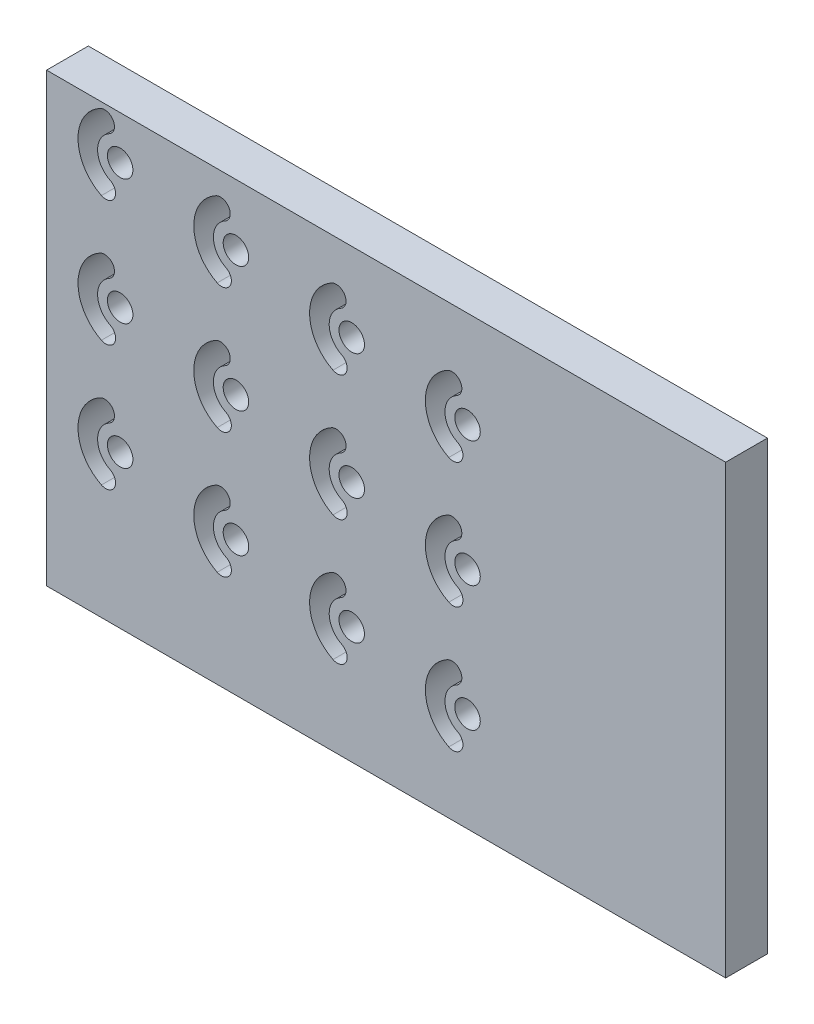
from build123d import *

# Parameters (mm, degrees)
F_1_FR_W        = 162.591921451
F_1_FR_H        = 106.952100423
F_1_FR_R        = 3.052899236
EXTRUDE_1_DEPTH = 10


with BuildPart() as part:
    # Эскиз1_fr → Бобышка-Вытянуть1 (new body)
    with BuildSketch(Plane.XY):
        with Locations((41.575310714, -4.636651753)):
            Rectangle(F_1_FR_W, F_1_FR_H)
        with Locations((-22.101373353, 38.438130748)):
            Circle(F_1_FR_R, mode=Mode.SUBTRACT)
        with Locations((5.621100062, 34.197733999)):
            Circle(F_1_FR_R, mode=Mode.SUBTRACT)
        with Locations((33.343573478, 29.95733725)):
            Circle(F_1_FR_R, mode=Mode.SUBTRACT)
        with Locations((61.066046893, 25.716940501)):
            Circle(F_1_FR_R, mode=Mode.SUBTRACT)
        with Locations((5.621100062, 4.197733999)):
            Circle(F_1_FR_R, mode=Mode.SUBTRACT)
        with Locations((33.343573478, -0.04266275)):
            Circle(F_1_FR_R, mode=Mode.SUBTRACT)
        with Locations((61.066046893, -4.283059499)):
            Circle(F_1_FR_R, mode=Mode.SUBTRACT)
        with Locations((5.621100062, -25.802266001)):
            Circle(F_1_FR_R, mode=Mode.SUBTRACT)
        with Locations((33.343573478, -30.04266275)):
            Circle(F_1_FR_R, mode=Mode.SUBTRACT)
        with Locations((61.066046893, -34.283059499)):
            Circle(F_1_FR_R, mode=Mode.SUBTRACT)
        with Locations((-22.101373353, 8.438130748)):
            Circle(F_1_FR_R, mode=Mode.SUBTRACT)
        with Locations((-22.101373353, -21.561869252)):
            Circle(F_1_FR_R, mode=Mode.SUBTRACT)
        with BuildLine():
            ThreePointArc((-26.934111294, 47.298150306), (-32.191806267, 38.242002753), (-26.586166309, 29.39700611))
            ThreePointArc((-26.586166309, 29.39700611), (-23.441936327, 30.456169349), (-24.501099566, 33.60039933))
            ThreePointArc((-24.501099566, 33.60039933), (-27.500569391, 38.33318644), (-24.687278216, 43.178956331))
            ThreePointArc((-24.687278216, 43.178956331), (-23.751097767, 46.361969857), (-26.934111294, 47.298150306))
        make_face(mode=Mode.SUBTRACT)
        with BuildLine():
            ThreePointArc((0.788362122, 43.057753557), (-4.469332851, 34.001606003), (1.136307107, 25.156609361))
            ThreePointArc((1.136307107, 25.156609361), (4.280537088, 26.2157726), (3.22137385, 29.360002581))
            ThreePointArc((3.22137385, 29.360002581), (0.221904024, 34.092789691), (3.035195199, 38.938559582))
            ThreePointArc((3.035195199, 38.938559582), (3.971375648, 42.121573108), (0.788362122, 43.057753557))
        make_face(mode=Mode.SUBTRACT)
        with BuildLine():
            ThreePointArc((28.510835537, 38.817356808), (23.253140564, 29.761209254), (28.858780522, 20.916212612))
            ThreePointArc((28.858780522, 20.916212612), (32.003010504, 21.975375851), (30.943847265, 25.119605832))
            ThreePointArc((30.943847265, 25.119605832), (27.94437744, 29.852392942), (30.757668615, 34.698162832))
            ThreePointArc((30.757668615, 34.698162832), (31.693849064, 37.881176359), (28.510835537, 38.817356808))
        make_face(mode=Mode.SUBTRACT)
        with BuildLine():
            ThreePointArc((56.233308952, 34.576960059), (50.97561398, 25.520812505), (56.581253938, 16.675815863))
            ThreePointArc((56.581253938, 16.675815863), (59.725483919, 17.734979101), (58.666320681, 20.879209083))
            ThreePointArc((58.666320681, 20.879209083), (55.666850855, 25.611996193), (58.48014203, 30.457766083))
            ThreePointArc((58.48014203, 30.457766083), (59.416322479, 33.64077961), (56.233308952, 34.576960059))
        make_face(mode=Mode.SUBTRACT)
        with BuildLine():
            ThreePointArc((0.788362122, 13.057753557), (-4.469332851, 4.001606003), (1.136307107, -4.843390639))
            ThreePointArc((1.136307107, -4.843390639), (4.280537088, -3.7842274), (3.22137385, -0.639997419))
            ThreePointArc((3.22137385, -0.639997419), (0.221904024, 4.092789691), (3.035195199, 8.938559582))
            ThreePointArc((3.035195199, 8.938559582), (3.971375648, 12.121573108), (0.788362122, 13.057753557))
        make_face(mode=Mode.SUBTRACT)
        with BuildLine():
            ThreePointArc((28.510835537, 8.817356808), (23.253140564, -0.238790746), (28.858780522, -9.083787388))
            ThreePointArc((28.858780522, -9.083787388), (32.003010504, -8.024624149), (30.943847265, -4.880394168))
            ThreePointArc((30.943847265, -4.880394168), (27.94437744, -0.147607058), (30.757668615, 4.698162832))
            ThreePointArc((30.757668615, 4.698162832), (31.693849064, 7.881176359), (28.510835537, 8.817356808))
        make_face(mode=Mode.SUBTRACT)
        with BuildLine():
            ThreePointArc((56.233308952, 4.576960059), (50.97561398, -4.479187495), (56.581253938, -13.324184137))
            ThreePointArc((56.581253938, -13.324184137), (59.725483919, -12.265020899), (58.666320681, -9.120790917))
            ThreePointArc((58.666320681, -9.120790917), (55.666850855, -4.388003807), (58.48014203, 0.457766083))
            ThreePointArc((58.48014203, 0.457766083), (59.416322479, 3.64077961), (56.233308952, 4.576960059))
        make_face(mode=Mode.SUBTRACT)
        with BuildLine():
            ThreePointArc((0.788362122, -16.942246443), (-4.469332851, -25.998393997), (1.136307107, -34.843390639))
            ThreePointArc((1.136307107, -34.843390639), (4.280537088, -33.7842274), (3.22137385, -30.639997419))
            ThreePointArc((3.22137385, -30.639997419), (0.221904024, -25.907210309), (3.035195199, -21.061440418))
            ThreePointArc((3.035195199, -21.061440418), (3.971375648, -17.878426892), (0.788362122, -16.942246443))
        make_face(mode=Mode.SUBTRACT)
        with BuildLine():
            ThreePointArc((28.510835537, -21.182643192), (23.253140564, -30.238790746), (28.858780522, -39.083787388))
            ThreePointArc((28.858780522, -39.083787388), (32.003010504, -38.024624149), (30.943847265, -34.880394168))
            ThreePointArc((30.943847265, -34.880394168), (27.94437744, -30.147607058), (30.757668615, -25.301837168))
            ThreePointArc((30.757668615, -25.301837168), (31.693849064, -22.118823641), (28.510835537, -21.182643192))
        make_face(mode=Mode.SUBTRACT)
        with BuildLine():
            ThreePointArc((56.233308952, -25.423039941), (50.97561398, -34.479187495), (56.581253938, -43.324184137))
            ThreePointArc((56.581253938, -43.324184137), (59.725483919, -42.265020899), (58.666320681, -39.120790917))
            ThreePointArc((58.666320681, -39.120790917), (55.666850855, -34.388003807), (58.48014203, -29.542233917))
            ThreePointArc((58.48014203, -29.542233917), (59.416322479, -26.35922039), (56.233308952, -25.423039941))
        make_face(mode=Mode.SUBTRACT)
        with BuildLine():
            ThreePointArc((-26.934111294, 17.298150306), (-32.191806267, 8.242002753), (-26.586166309, -0.60299389))
            ThreePointArc((-26.586166309, -0.60299389), (-23.441936327, 0.456169349), (-24.501099566, 3.60039933))
            ThreePointArc((-24.501099566, 3.60039933), (-27.500569391, 8.33318644), (-24.687278216, 13.178956331))
            ThreePointArc((-24.687278216, 13.178956331), (-23.751097767, 16.361969857), (-26.934111294, 17.298150306))
        make_face(mode=Mode.SUBTRACT)
        with BuildLine():
            ThreePointArc((-26.934111294, -12.701849694), (-32.191806267, -21.757997247), (-26.586166309, -30.60299389))
            ThreePointArc((-26.586166309, -30.60299389), (-23.441936327, -29.543830651), (-24.501099566, -26.39960067))
            ThreePointArc((-24.501099566, -26.39960067), (-27.500569391, -21.66681356), (-24.687278216, -16.821043669))
            ThreePointArc((-24.687278216, -16.821043669), (-23.751097767, -13.638030143), (-26.934111294, -12.701849694))
        make_face(mode=Mode.SUBTRACT)
    extrude(amount=EXTRUDE_1_DEPTH)


solid = part.part
